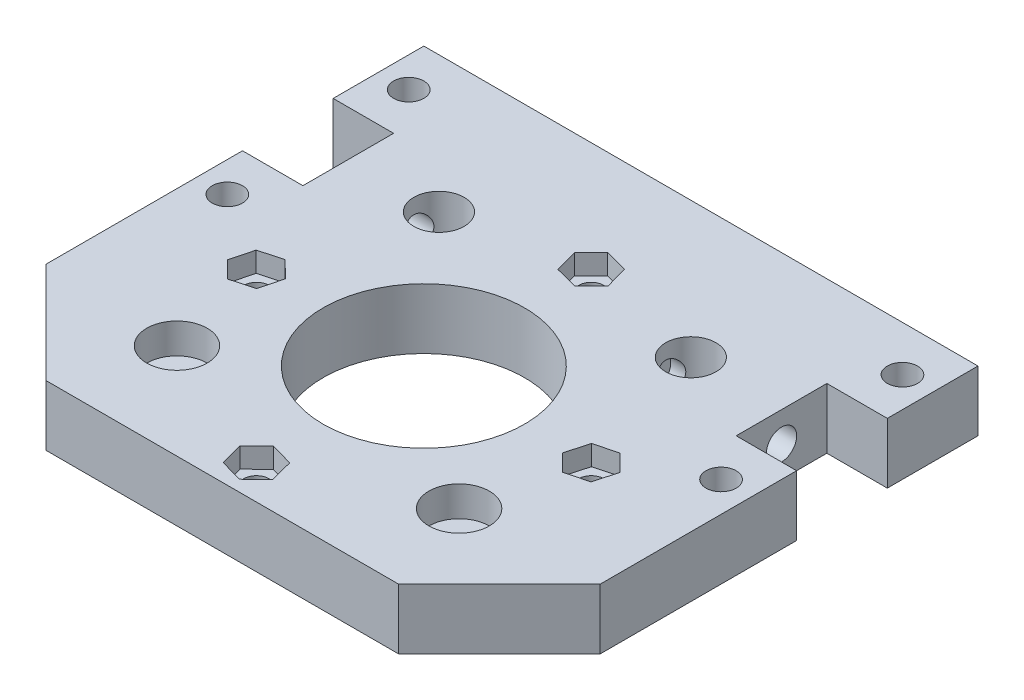
from build123d import *

# Parameters (mm, degrees)
SKETCH1_W           = 66
SKETCH1_H           = 95
SKETCH1_R           = 20
BOSS_EXTRUDE1_DEPTH = 12
BOSS_EXTRUDE3_DEPTH = 12
SKETCH6_R           = 6
CUT_EXTRUDE2_DEPTH  = 6
CHAMFER1_SIZE       = 20
CUT_EXTRUDE3_REACH  = 91.828
SKETCH7_R           = 3
SKETCH7_R_2         = 5
SKETCH9_R           = 3
CUT_EXTRUDE5_DEPTH  = 25
CUT_EXTRUDE6_REACH  = 91.828
SKETCH10_R          = 2.5
CUT_EXTRUDE7_DEPTH  = 4


with BuildPart() as part:
    # Sketch1 → Boss-Extrude1 (new body)
    with BuildSketch(Plane(origin=(0, 0, 0), x_dir=(1, 0, 0), z_dir=(0, 1, 0))):
        with Locations((0, -22.5)):
            Rectangle(SKETCH1_W, SKETCH1_H)
        with Locations(Location((0, -30, 0), (0, 0, 270))):
            Circle(SKETCH1_R, mode=Mode.SUBTRACT)
    extrude(amount=BOSS_EXTRUDE1_DEPTH)

    # Sketch3 → Boss-Extrude3 (add)
    with BuildSketch(Plane(origin=(0, 12, 0), x_dir=(1, 0, 0), z_dir=(0, 1, 0))):
        Polygon((55, 7), (43, 7), (43, -11), (55, -11), (55, -70), (33, -70), (33, 25), (55, 25), align=None)
    boss_extrude3 = extrude(amount=-BOSS_EXTRUDE3_DEPTH)

    # Mirror1: Boss-Extrude3 across plane
    add(boss_extrude3.mirror(Plane(origin=(0, 0, 0), x_dir=(0, 0, 1), z_dir=(1, 0, 0))))

    # Sketch6 → Cut-Extrude2 (cut)
    with BuildSketch(Plane(origin=(0, 12, 0), x_dir=(1, 0, 0), z_dir=(0, 1, 0))):
        with Locations(Location((-28, -51, 0), (0, 0, 270))):
            Circle(SKETCH6_R)
        with Locations(Location((28, -51, 0), (0, 0, 270))):
            Circle(SKETCH6_R)
    extrude(amount=-CUT_EXTRUDE2_DEPTH, mode=Mode.SUBTRACT)

    # Chamfer1
    chamfer1_edges = [part.edges().sort_by_distance(p)[0] for p in [
        (55, 6, 70),
        (-55, 6, 70),
    ]]
    chamfer(chamfer1_edges, length=CHAMFER1_SIZE)

    # Sketch7 → Cut-Extrude3 (cut, up to next)
    with BuildSketch(Plane(origin=(0, 12, 0), x_dir=(1, 0, 0), z_dir=(0, 1, 0)), mode=Mode.PRIVATE) as cut_extrude3_sk1:
        with Locations(Location((-49, 16, 0), (0, 0, 270))):
            Circle(SKETCH7_R)
    cut_extrude3_tool1 = extrude(cut_extrude3_sk1.sketch, amount=-CUT_EXTRUDE3_REACH, mode=Mode.PRIVATE) & part.part
    # Sketch7 → Cut-Extrude3 (cut, up to next)
    with BuildSketch(Plane(origin=(0, 12, 0), x_dir=(1, 0, 0), z_dir=(0, 1, 0)), mode=Mode.PRIVATE) as cut_extrude3_sk2:
        with Locations(Location((-49, -20, 0), (0, 0, 270))):
            Circle(SKETCH7_R)
    cut_extrude3_tool2 = extrude(cut_extrude3_sk2.sketch, amount=-CUT_EXTRUDE3_REACH, mode=Mode.PRIVATE) & part.part
    # Sketch7 → Cut-Extrude3 (cut, up to next)
    with BuildSketch(Plane(origin=(0, 12, 0), x_dir=(1, 0, 0), z_dir=(0, 1, 0)), mode=Mode.PRIVATE) as cut_extrude3_sk3:
        with Locations(Location((-25, -2, 0), (0, 0, 270))):
            Circle(SKETCH7_R_2)
    cut_extrude3_tool3 = extrude(cut_extrude3_sk3.sketch, amount=-CUT_EXTRUDE3_REACH, mode=Mode.PRIVATE) & part.part
    cut_extrude3_1 = cut_extrude3_tool1.solids().sort_by_distance((-49, 12, -16))[0]
    add(cut_extrude3_1, mode=Mode.SUBTRACT)
    cut_extrude3_2 = cut_extrude3_tool2.solids().sort_by_distance((-49, 12, 20))[0]
    add(cut_extrude3_2, mode=Mode.SUBTRACT)
    cut_extrude3_3 = cut_extrude3_tool3.solids().sort_by_distance((-25, 12, 2))[0]
    add(cut_extrude3_3, mode=Mode.SUBTRACT)
    cut_extrude3 = cut_extrude3_1 + cut_extrude3_2 + cut_extrude3_3  # Cut-Extrude3 as one shape, for the pattern or mirror that repeats it

    # Sketch9 → Cut-Extrude5 (cut)
    with BuildSketch(Plane.ZY.offset(43)):
        with Locations((2, 6)):
            Circle(SKETCH9_R)
    cut_extrude5 = extrude(amount=-CUT_EXTRUDE5_DEPTH, mode=Mode.SUBTRACT)

    # Mirror2: Cut-Extrude3, Cut-Extrude5 across plane
    add(cut_extrude3.mirror(Plane(origin=(0, 0, 0), x_dir=(0, 0, 1), z_dir=(1, 0, 0))), mode=Mode.SUBTRACT)
    add(cut_extrude5.mirror(Plane(origin=(0, 0, 0), x_dir=(0, 0, 1), z_dir=(1, 0, 0))), mode=Mode.SUBTRACT)

    # Sketch10 → Cut-Extrude6 (cut, up to next)
    with BuildSketch(Plane.XZ, mode=Mode.PRIVATE) as cut_extrude6_sk1:
        with Locations(Location((0, 63.234018716, 0), (0, 0, 270))):
            Circle(SKETCH10_R)
    cut_extrude6_tool1 = extrude(cut_extrude6_sk1.sketch, amount=-CUT_EXTRUDE6_REACH, mode=Mode.PRIVATE) & part.part
    # Sketch10 → Cut-Extrude6 (cut, up to next)
    with BuildSketch(Plane.XZ, mode=Mode.PRIVATE) as cut_extrude6_sk2:
        with Locations(Location((-33.234018716, 30, 0), (0, 0, 270))):
            Circle(SKETCH10_R)
    cut_extrude6_tool2 = extrude(cut_extrude6_sk2.sketch, amount=-CUT_EXTRUDE6_REACH, mode=Mode.PRIVATE) & part.part
    # Sketch10 → Cut-Extrude6 (cut, up to next)
    with BuildSketch(Plane.XZ, mode=Mode.PRIVATE) as cut_extrude6_sk3:
        with Locations(Location((0, -3.234018716, 0), (0, 0, 270))):
            Circle(SKETCH10_R)
    cut_extrude6_tool3 = extrude(cut_extrude6_sk3.sketch, amount=-CUT_EXTRUDE6_REACH, mode=Mode.PRIVATE) & part.part
    # Sketch10 → Cut-Extrude6 (cut, up to next)
    with BuildSketch(Plane.XZ, mode=Mode.PRIVATE) as cut_extrude6_sk4:
        with Locations(Location((33.234018716, 30, 0), (0, 0, 270))):
            Circle(SKETCH10_R)
    cut_extrude6_tool4 = extrude(cut_extrude6_sk4.sketch, amount=-CUT_EXTRUDE6_REACH, mode=Mode.PRIVATE) & part.part
    add(cut_extrude6_tool1.solids().sort_by_distance((0, 0, 63.234019))[0], mode=Mode.SUBTRACT)
    add(cut_extrude6_tool2.solids().sort_by_distance((-33.234019, 0, 30))[0], mode=Mode.SUBTRACT)
    add(cut_extrude6_tool3.solids().sort_by_distance((0, 0, -3.234019))[0], mode=Mode.SUBTRACT)
    add(cut_extrude6_tool4.solids().sort_by_distance((33.234019, 0, 30))[0], mode=Mode.SUBTRACT)

    # Sketch12 → Cut-Extrude7 (cut)
    with BuildSketch(Plane(origin=(0, 12, 0), x_dir=(1, 0, 0), z_dir=(0, 1, 0))):
        Polygon((3.334261142, -59.954887332), (-1.17268051, -58.706898172), (-4.506941652, -61.986029556), (-3.334261142, -66.5131501), (1.17268051, -67.76113926), (4.506941652, -64.482007876), align=None)
        Polygon((-29.899757573, -33.279131384), (-28.727077064, -28.75201084), (-32.061338206, -25.472879456), (-36.568279858, -26.720868616), (-37.740960368, -31.24798916), (-34.406699225, -34.527120544), align=None)
        Polygon((-3.282764492, -0.096665492), (1.24307489, -1.274280833), (4.525839382, 2.056403375), (3.282764492, 6.564702924), (-1.24307489, 7.742318264), (-4.525839382, 4.411634056), align=None)
        Polygon((29.951254224, -26.669315792), (28.708179334, -31.177615341), (31.990943826, -34.508299548), (36.516783208, -33.330684208), (37.759858098, -28.822384659), (34.477093606, -25.491700452), align=None)
    extrude(amount=-CUT_EXTRUDE7_DEPTH, mode=Mode.SUBTRACT)


solid = part.part
